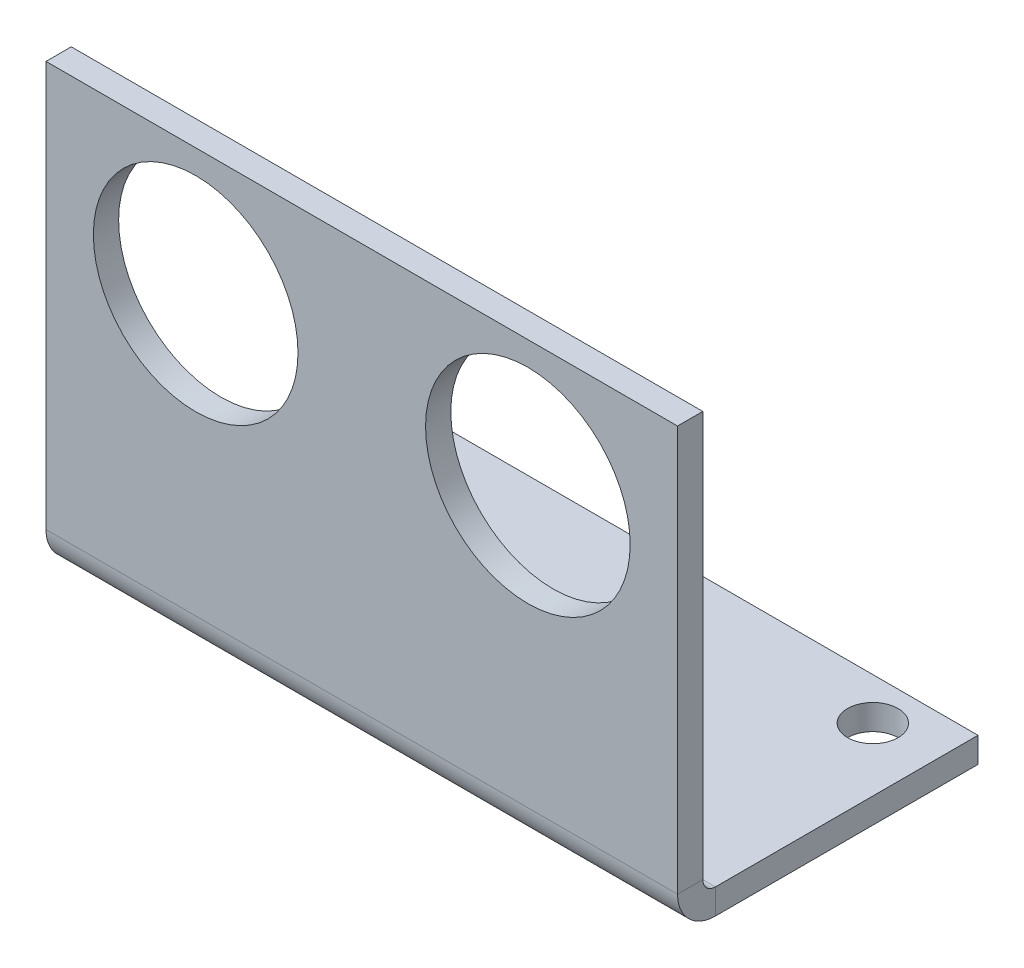
from build123d import *

# Parameters (mm, degrees)
SKETCH1_W           = 50
SKETCH1_H           = 30
SKETCH1_R           = 8.1
BOSS_EXTRUDE1_DEPTH = 2
SKETCH3_W           = 50
SKETCH3_H           = 2
SKETCH5_R           = 2
CUT_EXTRUDE1_DEPTH  = 47.853803709


with BuildPart() as part:
    # Sketch1 → Boss-Extrude1 (new body)
    with BuildSketch(Plane.XY):
        Rectangle(SKETCH1_W, SKETCH1_H)
        with Locations((13.15, 5)):
            Circle(SKETCH1_R, mode=Mode.SUBTRACT)
        with Locations(Location((-13.15, 5, 0), (0, 0, 180))):
            Circle(SKETCH1_R, mode=Mode.SUBTRACT)
    extrude(amount=BOSS_EXTRUDE1_DEPTH)

    # Sweep1: sweep along a path in Sketch2
    with BuildLine(Plane(origin=(25, 0, 0), x_dir=(0, 0, -1), z_dir=(1, 0, 0))) as sweep1_path:
        Line((-1, -15), (-1, -17.099519782))
        ThreePointArc((-1, -17.099519782), (-0.414213562, -18.513733344), (1, -19.099519782))
        Line((1, -19.099519782), (21.787627504, -19.099519782))
    # Sketch3 → Sweep1 (sweep)
    with BuildSketch(Plane.XZ.offset(15)):
        with Locations((0, 1)):
            Rectangle(SKETCH3_W, SKETCH3_H)
    sweep(path=sweep1_path.line)

    # Sketch5 → Cut-Extrude1 (cut, through all)
    with BuildSketch(Plane(origin=(0, -18.099519782, 0), x_dir=(1, 0, 0), z_dir=(0, 1, 0))):
        with Locations(Location((-20, 18.460437776, 0), (0, 0, 270))):
            Circle(SKETCH5_R)
        with Locations(Location((20, 18.460437776, 0), (0, 0, 90))):
            Circle(SKETCH5_R)
    extrude(amount=-CUT_EXTRUDE1_DEPTH, mode=Mode.SUBTRACT)


solid = part.part
